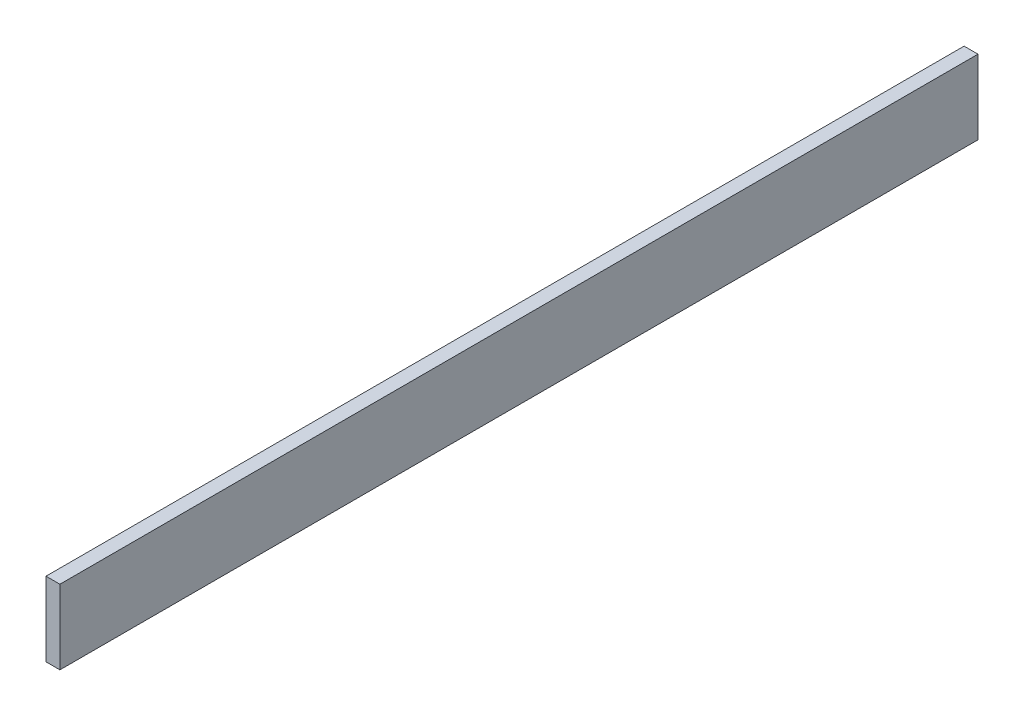
from build123d import *

# Parameters (mm, degrees)
SKETCH1_W           = 1257.3
SKETCH1_H           = 101.6
BOSS_EXTRUDE1_DEPTH = 19.05


with BuildPart() as part:
    # Sketch1 → Boss-Extrude1 (new body)
    with BuildSketch(Plane(origin=(0, 0, 0), x_dir=(0, 0, -1), z_dir=(1, 0, 0))):
        Rectangle(SKETCH1_W, SKETCH1_H)
    extrude(amount=BOSS_EXTRUDE1_DEPTH)


solid = part.part
